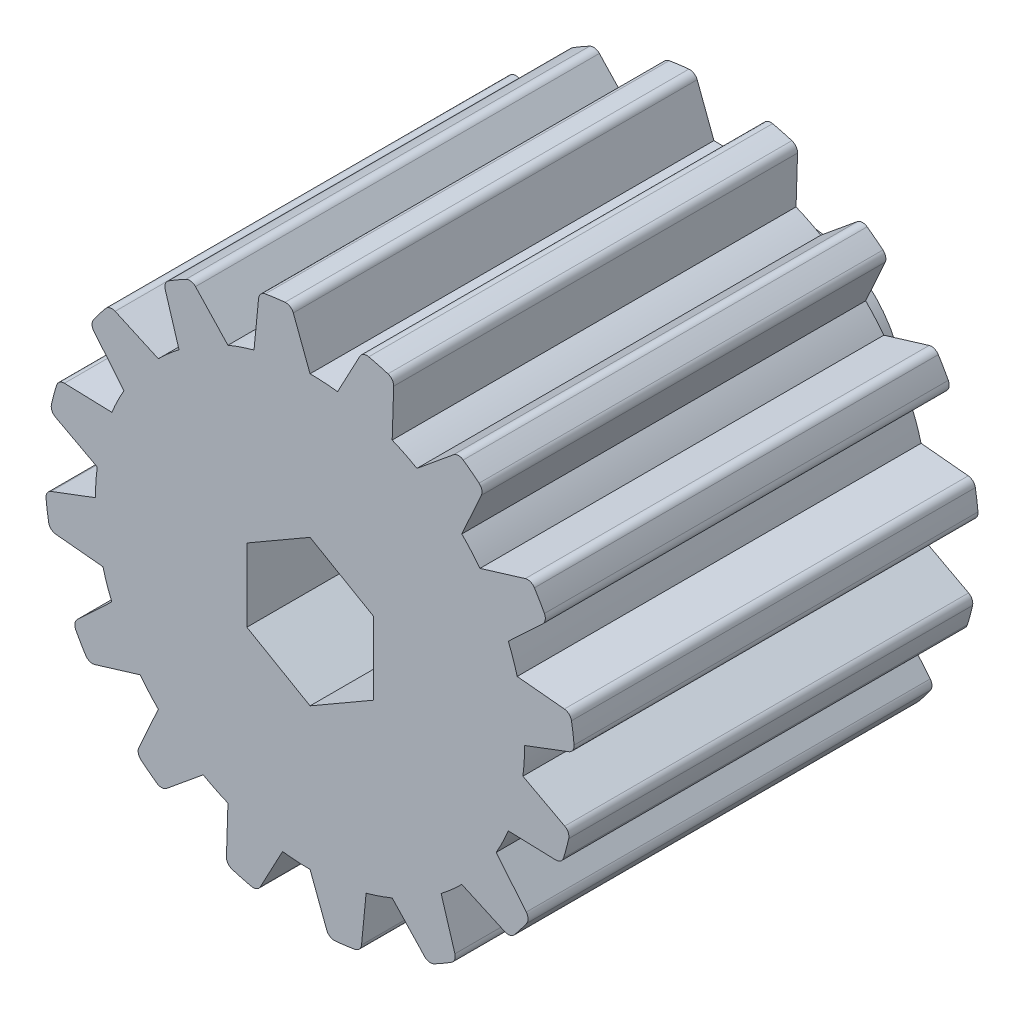
from build123d import *

# Parameters (mm, degrees)
SALIENTE_EXTRUIR1_DEPTH    = 15
CROQUIS5_R                 = 4.5
SALIENTE_EXTRUIR2_DEPTH    = 6
ESCALA1_SCALE              = 1.5
CORTAR_EXTRUIR3_DEPTH      = 38.7502155
CORTAR_EXTRUIR3_DEPTH_BACK = 5.8
CROQUIS7_R                 = 10
CROQUIS8_R                 = 5.5
SALIENTE_EXTRUIR3_DEPTH    = 1.87
CORTAR_EXTRUIR4_DEPTH      = 35.538871873
CORTAR_EXTRUIR4_DEPTH_BACK = 35.538871873


with BuildPart() as part:
    # Croquis2 → Saliente-Extruir1 (new body)
    with BuildSketch(Plane.XY):
        with BuildLine():
            Line((-2.081696937, 7.693567449), (-1.911179214, 9.445287663))
            ThreePointArc((-1.911179214, 9.445287663), (-1.831468139, 9.618345927), (-1.663611198, 9.708496165))
            ThreePointArc((-1.663611198, 9.708496165), (-1.297642615, 9.764149919), (-0.929841298, 9.806013214))
            ThreePointArc((-0.929841298, 9.806013214), (-0.744265019, 9.762833784), (-0.622120698, 9.616601835))
            Line((-0.622120698, 9.616601835), (0, 7.97022222))
            ThreePointArc((0, 7.97022222), (0.511536449, 7.953789832), (1.020963606, 7.904560428))
            Line((1.020963606, 7.904560428), (1.848855744, 9.457684572))
            ThreePointArc((1.848855744, 9.457684572), (1.988725705, 9.587065453), (2.1783043, 9.606117341))
            ThreePointArc((2.1783043, 9.606117341), (2.537712953, 9.517484592), (2.893537451, 9.415409764))
            ThreePointArc((2.893537451, 9.415409764), (3.048463524, 9.304500205), (3.105349619, 9.122656892))
            Line((3.105349619, 9.122656892), (3.050071996, 7.363525179))
            ThreePointArc((3.050071996, 7.363525179), (3.516381649, 7.152587108), (3.968191694, 6.912155736))
            Line((3.968191694, 6.912155736), (5.327419174, 8.030234739))
            ThreePointArc((5.327419174, 8.030234739), (5.506154088, 8.09624117), (5.688592714, 8.041294232))
            ThreePointArc((5.688592714, 8.041294232), (5.986724728, 7.821868513), (6.276401353, 7.591395527))
            ThreePointArc((6.276401353, 7.591395527), (6.37709113, 7.429640815), (6.360058606, 7.239870134))
            Line((6.360058606, 7.239870134), (5.635798179, 5.635798179))
            ThreePointArc((5.635798179, 5.635798179), (5.985889619, 5.262467835), (6.311298569, 4.867437992))
            Line((6.311298569, 4.867437992), (7.994931329, 5.380254461))
            ThreePointArc((7.994931329, 5.380254461), (8.185320425, 5.372837562), (8.332844455, 5.252256971))
            ThreePointArc((8.332844455, 5.252256971), (8.524311933, 4.935443857), (8.703740045, 4.611660138))
            ThreePointArc((8.703740045, 4.611660138), (8.73486442, 4.42368596), (8.646506324, 4.254878777))
            Line((8.646506324, 4.254878777), (7.363525179, 3.050071996))
            ThreePointArc((7.363525179, 3.050071996), (7.544100156, 2.571185538), (7.693567449, 2.081696937))
            Line((7.693567449, 2.081696937), (9.445287663, 1.911179214))
            ThreePointArc((9.445287663, 1.911179214), (9.618345927, 1.831468139), (9.708496165, 1.663611198))
            ThreePointArc((9.708496165, 1.663611198), (9.764149919, 1.297642615), (9.806013214, 0.929841298))
            ThreePointArc((9.806013214, 0.929841298), (9.762833784, 0.744265019), (9.616601835, 0.622120698))
            Line((9.616601835, 0.622120698), (7.97022222, 0))
            ThreePointArc((7.97022222, 0), (7.953789832, -0.511536449), (7.904560428, -1.020963606))
            Line((7.904560428, -1.020963606), (9.457684572, -1.848855744))
            ThreePointArc((9.457684572, -1.848855744), (9.587065453, -1.988725705), (9.606117341, -2.1783043))
            ThreePointArc((9.606117341, -2.1783043), (9.517484592, -2.537712953), (9.415409764, -2.893537451))
            ThreePointArc((9.415409764, -2.893537451), (9.304500205, -3.048463524), (9.122656892, -3.105349619))
            Line((9.122656892, -3.105349619), (7.363525179, -3.050071996))
            ThreePointArc((7.363525179, -3.050071996), (7.152587108, -3.516381649), (6.912155736, -3.968191694))
            Line((6.912155736, -3.968191694), (8.030234739, -5.327419174))
            ThreePointArc((8.030234739, -5.327419174), (8.09624117, -5.506154088), (8.041294232, -5.688592714))
            ThreePointArc((8.041294232, -5.688592714), (7.821868513, -5.986724728), (7.591395527, -6.276401353))
            ThreePointArc((7.591395527, -6.276401353), (7.429640815, -6.37709113), (7.239870134, -6.360058606))
            Line((7.239870134, -6.360058606), (5.635798179, -5.635798179))
            ThreePointArc((5.635798179, -5.635798179), (5.262467835, -5.985889619), (4.867437992, -6.311298569))
            Line((4.867437992, -6.311298569), (5.380254461, -7.994931329))
            ThreePointArc((5.380254461, -7.994931329), (5.372837562, -8.185320425), (5.252256971, -8.332844455))
            ThreePointArc((5.252256971, -8.332844455), (4.935443857, -8.524311933), (4.611660138, -8.703740045))
            ThreePointArc((4.611660138, -8.703740045), (4.42368596, -8.73486442), (4.254878777, -8.646506324))
            Line((4.254878777, -8.646506324), (3.050071996, -7.363525179))
            ThreePointArc((3.050071996, -7.363525179), (2.571185538, -7.544100156), (2.081696937, -7.693567449))
            Line((2.081696937, -7.693567449), (1.911179214, -9.445287663))
            ThreePointArc((1.911179214, -9.445287663), (1.831468139, -9.618345927), (1.663611198, -9.708496165))
            ThreePointArc((1.663611198, -9.708496165), (1.297642615, -9.764149919), (0.929841298, -9.806013214))
            ThreePointArc((0.929841298, -9.806013214), (0.744265019, -9.762833784), (0.622120698, -9.616601835))
            Line((0.622120698, -9.616601835), (0, -7.97022222))
            ThreePointArc((0, -7.97022222), (-0.511536449, -7.953789832), (-1.020963606, -7.904560428))
            Line((-1.020963606, -7.904560428), (-1.848855744, -9.457684572))
            ThreePointArc((-1.848855744, -9.457684572), (-1.988725705, -9.587065453), (-2.1783043, -9.606117341))
            ThreePointArc((-2.1783043, -9.606117341), (-2.537712953, -9.517484592), (-2.893537451, -9.415409764))
            ThreePointArc((-2.893537451, -9.415409764), (-3.048463524, -9.304500205), (-3.105349619, -9.122656892))
            Line((-3.105349619, -9.122656892), (-3.050071996, -7.363525179))
            ThreePointArc((-3.050071996, -7.363525179), (-3.516381649, -7.152587108), (-3.968191694, -6.912155736))
            Line((-3.968191694, -6.912155736), (-5.327419174, -8.030234739))
            ThreePointArc((-5.327419174, -8.030234739), (-5.506154088, -8.09624117), (-5.688592714, -8.041294232))
            ThreePointArc((-5.688592714, -8.041294232), (-5.986724728, -7.821868513), (-6.276401353, -7.591395527))
            ThreePointArc((-6.276401353, -7.591395527), (-6.37709113, -7.429640815), (-6.360058606, -7.239870134))
            Line((-6.360058606, -7.239870134), (-5.635798179, -5.635798179))
            ThreePointArc((-5.635798179, -5.635798179), (-5.985889619, -5.262467835), (-6.311298569, -4.867437992))
            Line((-6.311298569, -4.867437992), (-7.994931329, -5.380254461))
            ThreePointArc((-7.994931329, -5.380254461), (-8.185320425, -5.372837562), (-8.332844455, -5.252256971))
            ThreePointArc((-8.332844455, -5.252256971), (-8.524311933, -4.935443857), (-8.703740045, -4.611660138))
            ThreePointArc((-8.703740045, -4.611660138), (-8.73486442, -4.42368596), (-8.646506324, -4.254878777))
            Line((-8.646506324, -4.254878777), (-7.363525179, -3.050071996))
            ThreePointArc((-7.363525179, -3.050071996), (-7.544100156, -2.571185538), (-7.693567449, -2.081696937))
            Line((-7.693567449, -2.081696937), (-9.445287663, -1.911179214))
            ThreePointArc((-9.445287663, -1.911179214), (-9.618345927, -1.831468139), (-9.708496165, -1.663611198))
            ThreePointArc((-9.708496165, -1.663611198), (-9.764149919, -1.297642615), (-9.806013214, -0.929841298))
            ThreePointArc((-9.806013214, -0.929841298), (-9.762833784, -0.744265019), (-9.616601835, -0.622120698))
            Line((-9.616601835, -0.622120698), (-7.97022222, 0))
            ThreePointArc((-7.97022222, 0), (-7.953789832, 0.511536449), (-7.904560428, 1.020963606))
            Line((-7.904560428, 1.020963606), (-9.457684572, 1.848855744))
            ThreePointArc((-9.457684572, 1.848855744), (-9.587065453, 1.988725705), (-9.606117341, 2.1783043))
            ThreePointArc((-9.606117341, 2.1783043), (-9.517484592, 2.537712953), (-9.415409764, 2.893537451))
            ThreePointArc((-9.415409764, 2.893537451), (-9.304500205, 3.048463524), (-9.122656892, 3.105349619))
            Line((-9.122656892, 3.105349619), (-7.363525179, 3.050071996))
            ThreePointArc((-7.363525179, 3.050071996), (-7.152587108, 3.516381649), (-6.912155736, 3.968191694))
            Line((-6.912155736, 3.968191694), (-8.030234739, 5.327419174))
            ThreePointArc((-8.030234739, 5.327419174), (-8.09624117, 5.506154088), (-8.041294232, 5.688592714))
            ThreePointArc((-8.041294232, 5.688592714), (-7.821868513, 5.986724728), (-7.591395527, 6.276401353))
            ThreePointArc((-7.591395527, 6.276401353), (-7.429640815, 6.37709113), (-7.239870134, 6.360058606))
            Line((-7.239870134, 6.360058606), (-5.635798179, 5.635798179))
            ThreePointArc((-5.635798179, 5.635798179), (-5.262467835, 5.985889619), (-4.867437992, 6.311298569))
            Line((-4.867437992, 6.311298569), (-5.380254461, 7.994931329))
            ThreePointArc((-5.380254461, 7.994931329), (-5.372837562, 8.185320425), (-5.252256971, 8.332844455))
            ThreePointArc((-5.252256971, 8.332844455), (-4.935443857, 8.524311933), (-4.611660138, 8.703740045))
            ThreePointArc((-4.611660138, 8.703740045), (-4.42368596, 8.73486442), (-4.254878777, 8.646506324))
            Line((-4.254878777, 8.646506324), (-3.050071996, 7.363525179))
            ThreePointArc((-3.050071996, 7.363525179), (-2.571185538, 7.544100156), (-2.081696937, 7.693567449))
        make_face()
    extrude(amount=SALIENTE_EXTRUIR1_DEPTH)

    # Croquis5 → Saliente-Extruir2 (add)
    with BuildSketch(Plane(origin=(0, 0, 0), x_dir=(-1, 0, 0), z_dir=(0, 0, -1))):
        with Locations(Location((0, 0, 0), (0, 0, 180))):
            Circle(CROQUIS5_R)
    extrude(amount=SALIENTE_EXTRUIR2_DEPTH)


with BuildPart() as part_1:
    # Escala1: scaled about (0, 0, 0)
    add(part.part.scale(ESCALA1_SCALE))

    # Croquis7 → Cortar-Extruir3 (cut, two sides: drawn at the far end of the back side and taken through both)
    with BuildSketch(Plane(origin=(0, 0, -9), x_dir=(-1, 0, 0), z_dir=(0, 0, -1)).offset(-CORTAR_EXTRUIR3_DEPTH_BACK)):
        Circle(CROQUIS7_R)
    extrude(amount=CORTAR_EXTRUIR3_DEPTH + CORTAR_EXTRUIR3_DEPTH_BACK, mode=Mode.SUBTRACT)

    # Croquis8 → Saliente-Extruir3 (add)
    with BuildSketch(Plane(origin=(0, 0, -3.2), x_dir=(-1, 0, 0), z_dir=(0, 0, -1))):
        Circle(CROQUIS8_R)
    extrude(amount=SALIENTE_EXTRUIR3_DEPTH)

    # Croquis10 → Cortar-Extruir4 (cut, two sides: drawn at the far end of the back side and taken through both)
    with BuildSketch(Plane.XY.offset(22.5).offset(-CORTAR_EXTRUIR4_DEPTH_BACK)):
        Polygon((0, 4.065470054), (-3.520800345, 2.032735027), (-3.520800345, -2.032735027), (0, -4.065470054), (3.520800345, -2.032735027), (3.520800345, 2.032735027), align=None)
    extrude(amount=CORTAR_EXTRUIR4_DEPTH + CORTAR_EXTRUIR4_DEPTH_BACK, mode=Mode.SUBTRACT)


solid = part_1.part
